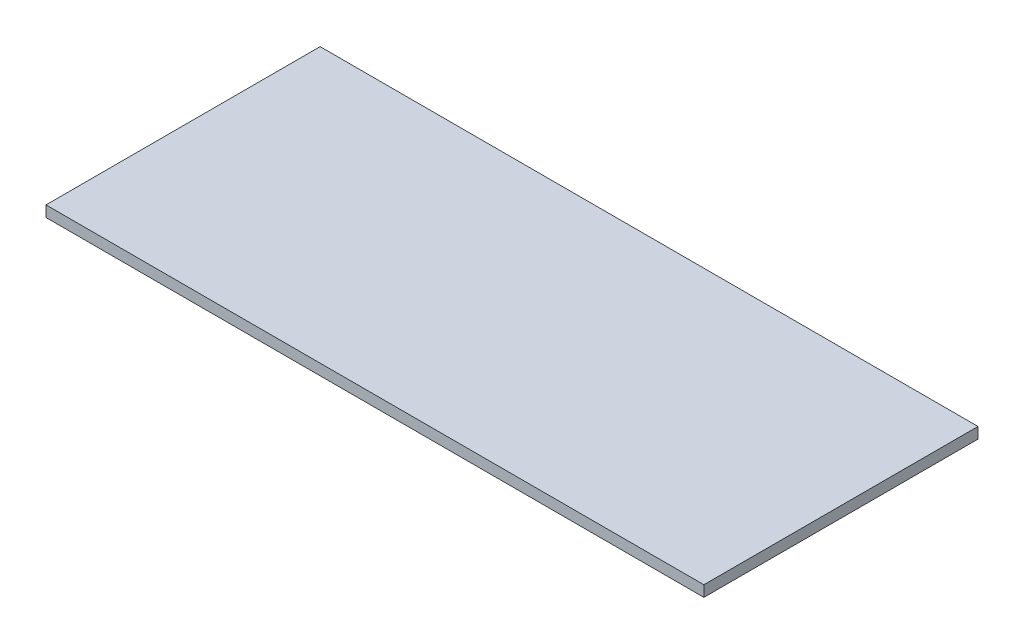
from build123d import *

# Parameters (mm, degrees)
SKETCH1_W           = 600
SKETCH1_H           = 250
BOSS_EXTRUDE1_DEPTH = 10


with BuildPart() as part:
    # Sketch1 → Boss-Extrude1 (new body)
    with BuildSketch(Plane(origin=(0, 0, 0), x_dir=(1, 0, 0), z_dir=(0, 1, 0))):
        Rectangle(SKETCH1_W, SKETCH1_H)
    extrude(amount=BOSS_EXTRUDE1_DEPTH)


solid = part.part
